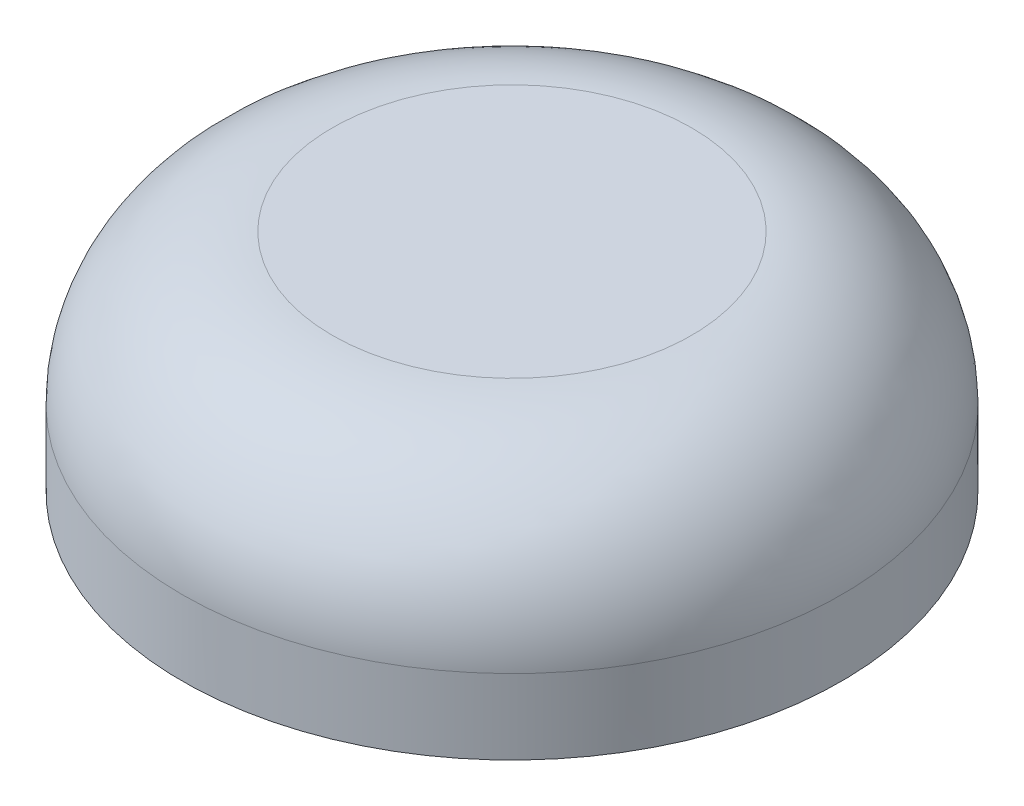
from build123d import *

# Parameters (mm, degrees)
SKETCH1_R           = 5.588
BOSS_EXTRUDE1_DEPTH = 3.81
SKETCH4_R           = 1.27
CUT_EXTRUDE1_DEPTH  = 2.54
FILLET5_R           = 2.54


with BuildPart() as part:
    # Sketch1 → Boss-Extrude1 (new body)
    with BuildSketch(Plane(origin=(0, 0, 0), x_dir=(1, 0, 0), z_dir=(0, 1, 0))):
        with Locations(Location((0, 0, 0), (0, 0, 90))):
            Circle(SKETCH1_R)
    extrude(amount=BOSS_EXTRUDE1_DEPTH)

    # Sketch4 → Cut-Extrude1 (cut)
    with BuildSketch(Plane.XZ):
        with Locations(Location((0, 0, 0), (0, 0, 270))):
            Circle(SKETCH4_R)
    extrude(amount=-CUT_EXTRUDE1_DEPTH, mode=Mode.SUBTRACT)

    # Fillet5
    fillet5_edges = [part.edges().sort_by_distance(p)[0] for p in [
        (0, 3.81, 5.588),
    ]]
    fillet(fillet5_edges, radius=FILLET5_R)


solid = part.part
